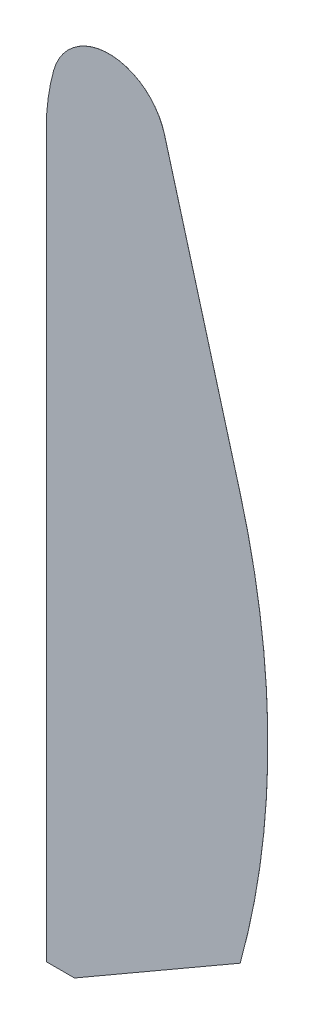
from build123d import *

# Parameters (mm, degrees)
BOSS_EXTRUDE1_DEPTH = 0.01


with BuildPart() as part:
    # Sketch1 → Boss-Extrude1 (new body)
    with BuildSketch(Plane(origin=(0, 0, 0), x_dir=(0, 1, 0), z_dir=(0, 0, 1))):
        with BuildLine():
            Line((0, 0), (127.875, 0))
            ThreePointArc((127.875, 0), (132.731880588, -0.329044492), (137.5, -1.310164565))
            ThreePointArc((137.5, -1.310164565), (144.967977443, -11.131593136), (137.5, -20.953021708))
            Line((137.5, -20.953021708), (89.111859788, -34.375))
            ThreePointArc((89.111859788, -34.375), (53.035761973, -39.285714286), (16.959664157, -34.375))
            Line((16.959664157, -34.375), (0, -5))
            Line((0, -5), (0, 0))
        make_face()
    extrude(amount=BOSS_EXTRUDE1_DEPTH)


solid = part.part
